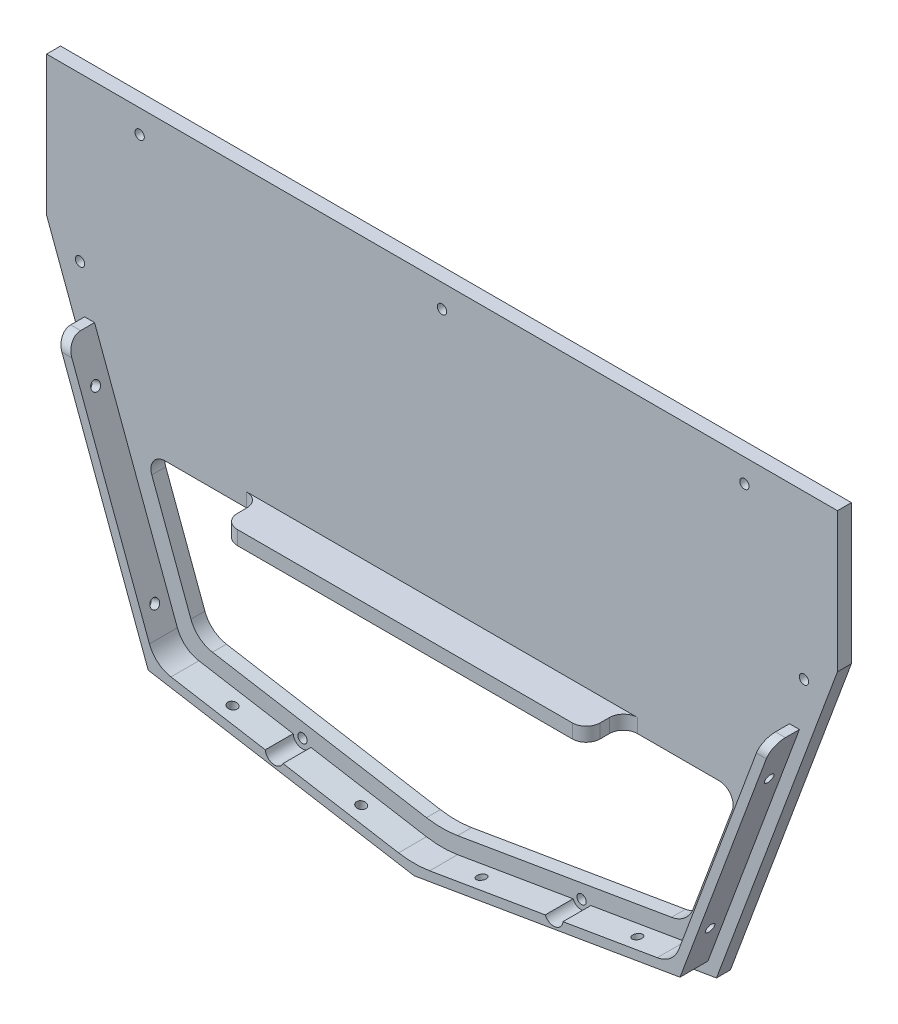
from build123d import *

# Parameters (mm, degrees)
BOSS_EXTRUDE1_DEPTH     = 3
BOSS_EXTRUDE2_DEPTH     = 6
FILLET1_R               = 20
FILLET2_R               = 6
FILLET4_R               = 3
SKETCH4_W               = 77.991272398
SKETCH4_H               = 3
BOSS_EXTRUDE3_DEPTH     = 8
FILLET5_R               = 3
CUT_EXTRUDE1_DEPTH      = 118
CUT_EXTRUDE1_DEPTH_BACK = 3
SKETCH5_R               = 1
SKETCH6_R               = 2
CUT_EXTRUDE2_DEPTH      = 6
FILLET6_R               = 3
SKETCH7_R               = 1
CUT_EXTRUDE3_DEPTH      = 3
SKETCH8_R               = 1
CUT_EXTRUDE4_DEPTH      = 3
SKETCH9_R               = 1
CUT_EXTRUDE5_DEPTH      = 3
SKETCH10_R              = 1
CUT_EXTRUDE6_DEPTH      = 3


with BuildPart() as part:
    # Sketch2 → Boss-Extrude1 (new body)
    with BuildSketch(Plane.XY):
        Polygon((85, 0), (85, 30), (-85, 30), (-85, 0), (-58.995636199, -70), (0, -80), (58.995636199, -70), align=None)
        Polygon((63.885527266, -33), (52.762165892, -62.942485887), (0, -71.885887347), (-52.762165892, -62.942485887), (-63.885527266, -33), align=None, mode=Mode.SUBTRACT)
    extrude(amount=BOSS_EXTRUDE1_DEPTH)

    # Sketch3 → Boss-Extrude2 (add)
    with BuildSketch(Plane.XY.offset(3)):
        Polygon((-74.691839611, -14.825881059), (-55.682056872, -65.99747679), (0, -75.435811633), (55.682056872, -65.99747679), (74.691839611, -14.825881059), (76.82538642, -14.825881059), (57.154758795, -67.776375994), (0, -77.464339796), (-57.154758795, -67.776375994), (-76.82538642, -14.825881059), align=None)
    extrude(amount=BOSS_EXTRUDE2_DEPTH)

    # Fillet1
    fillet1_edges = [part.edges().sort_by_distance(p)[0] for p in [
        (0, -71.885887347, 1.5),
        (0, -75.435811633, 6),
    ]]
    fillet(fillet1_edges, radius=FILLET1_R)

    # Fillet2
    fillet2_edges = [part.edges().sort_by_distance(p)[0] for p in [
        (-52.762165892, -62.942485887, 1.5),
        (52.762165892, -62.942485887, 1.5),
        (55.682056872, -65.99747679, 6),
        (-55.682056872, -65.99747679, 6),
    ]]
    fillet(fillet2_edges, radius=FILLET2_R)

    # Fillet4
    fillet4_edges = [part.edges().sort_by_distance(p)[0] for p in [
        (63.885527266, -33, 1.5),
        (-63.885527266, -33, 1.5),
    ]]
    fillet(fillet4_edges, radius=FILLET4_R)

    # Sketch4 → Boss-Extrude3 (add)
    with BuildSketch(Plane.XY.offset(3)):
        with Locations((0, -31.5)):
            Rectangle(SKETCH4_W, SKETCH4_H)
    extrude(amount=BOSS_EXTRUDE3_DEPTH)

    # Fillet5
    fillet5_edges = [part.edges().sort_by_distance(p)[0] for p in [
        (-38.995636199, -31.5, 3),
        (38.995636199, -31.5, 3),
        (-38.995636199, -31.5, 11),
        (38.995636199, -31.5, 11),
    ]]
    fillet(fillet5_edges, radius=FILLET5_R)

    # Sketch5 → Cut-Extrude1 (cut, two sides: drawn at the far end of the back side and taken through both)
    with BuildSketch(Plane.XY.offset(3).offset(-CUT_EXTRUDE1_DEPTH_BACK)):
        with Locations(Location((-65, 25, 0), (0, 0, 180))):
            Circle(SKETCH5_R)
        with Locations(Location((65, 25, 0), (0, 0, 180))):
            Circle(SKETCH5_R)
        with Locations(Location((0, 25, 0), (0, 0, 180))):
            Circle(SKETCH5_R)
        with Locations(Location((-77.808678419, -5, 0), (0, 0, 180))):
            Circle(SKETCH5_R)
        with Locations(Location((77.808678419, -5, 0), (0, 0, 180))):
            Circle(SKETCH5_R)
        with Locations(Location((-30, -69.84355772, 0), (0, 0, 200.379573945))):
            Circle(SKETCH5_R)
        with Locations(Location((30, -69.84355772, 0), (0, 0, 219.620426055))):
            Circle(SKETCH5_R)
    extrude(amount=CUT_EXTRUDE1_DEPTH + CUT_EXTRUDE1_DEPTH_BACK, mode=Mode.SUBTRACT)

    # Sketch6 → Cut-Extrude2 (cut)
    with BuildSketch(Plane.XY.offset(9)):
        with Locations((30, -69.84355772)):
            Circle(SKETCH6_R)
        with Locations((-30, -69.84355772)):
            Circle(SKETCH6_R)
    extrude(amount=-CUT_EXTRUDE2_DEPTH, mode=Mode.SUBTRACT)

    # Fillet6
    fillet6_edges = [part.edges().sort_by_distance(p)[0] for p in [
        (-75.758613015, -14.825881059, 9),
        (75.758613015, -14.825881059, 9),
    ]]
    fillet(fillet6_edges, radius=FILLET6_R)

    # Sketch7 → Cut-Extrude3 (cut)
    with BuildSketch(Plane(origin=(-72.348566579, -26.876834941, 0), x_dir=(0, 0, 1), z_dir=(-0.9374061965324084, -0.3482378823486089, 0))):
        with Locations(Location((6, 2.855637104, 0), (0, 0, 270))):
            Circle(SKETCH7_R)
        with Locations(Location((6, -33.630542667, 0), (0, 0, 270))):
            Circle(SKETCH7_R)
    extrude(amount=-CUT_EXTRUDE3_DEPTH, mode=Mode.SUBTRACT)

    # Sketch8 → Cut-Extrude4 (cut)
    with BuildSketch(Plane(origin=(72.348566579, -26.876834941, 0), x_dir=(0, 0, -1), z_dir=(0.9374061965324085, -0.3482378823486088, 0))):
        with Locations(Location((-6, 2.855637104, 0), (0, 0, 90))):
            Circle(SKETCH8_R)
        with Locations(Location((-6, -33.630542667, 0), (0, 0, 90))):
            Circle(SKETCH8_R)
    extrude(amount=-CUT_EXTRUDE4_DEPTH, mode=Mode.SUBTRACT)

    # Sketch9 → Cut-Extrude5 (cut)
    with BuildSketch(Plane(origin=(-12.429555178, -73.328951536, 0), x_dir=(0.9859365210363187, -0.1671202455922104, 0), z_dir=(0.1671202455922104, 0.9859365210363187, 0))):
        with Locations(Location((-1.969388477, -6, 0), (0, 0, 180))):
            Circle(SKETCH9_R)
        with Locations(Location((-30.024159445, -6, 0), (0, 0, 180))):
            Circle(SKETCH9_R)
    extrude(amount=-CUT_EXTRUDE5_DEPTH, mode=Mode.SUBTRACT)

    # Sketch10 → Cut-Extrude6 (cut)
    with BuildSketch(Plane(origin=(12.763795669, -75.300824578, 0), x_dir=(0.9859365210363187, 0.1671202455922103, 0), z_dir=(0.1671202455922103, -0.9859365210363187, 0))):
        with Locations((-0.945859491, 6)):
            Circle(SKETCH10_R)
        with Locations((33.024159445, 6)):
            Circle(SKETCH10_R)
    extrude(amount=-CUT_EXTRUDE6_DEPTH, mode=Mode.SUBTRACT)


solid = part.part
